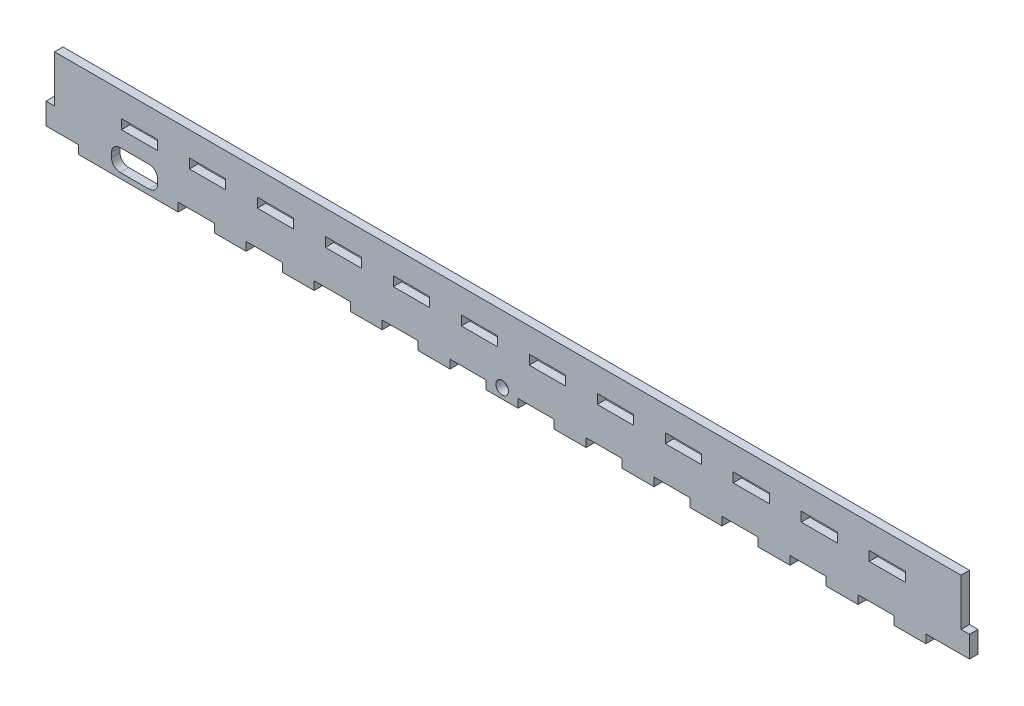
from build123d import *

# Parameters (mm, degrees)
ESQUISSE1_W             = 217.36
ESQUISSE1_H             = 12.11
BOSS_EXTRU_1_DEPTH      = 2
ESQUISSE2_W             = 8.5
ESQUISSE2_H             = 2
ESQUISSE2_W_2           = 10.25
ENL_V_MAT_EXTRU_1_DEPTH = 109.866916118
ENL_V_MAT_EXTRU_2_DEPTH = 109.866916118
ESQUISSE5_W             = 2
ESQUISSE5_H             = 5.055
ENL_V_MAT_EXTRU_3_DEPTH = 109.866916118
ESQUISSE6_W             = 213.36
ESQUISSE6_H             = 6
BOSS_EXTRU_2_DEPTH      = 2
ESQUISSE7_W             = 8.5
ESQUISSE7_H             = 0.25
ENL_V_MAT_EXTRU_4_DEPTH = 110.364827184
SKETCH1_R               = 1.5
CUT_EXTRUDE1_DEPTH      = 110.364827184


with BuildPart() as part:
    # Esquisse1 → Boss.-Extru.1 (new body)
    with BuildSketch(Plane.XY):
        Rectangle(ESQUISSE1_W, ESQUISSE1_H)
    extrude(amount=BOSS_EXTRU_1_DEPTH)

    # Esquisse2 → Enlèv. mat.-Extru.1 (cut, through all)
    with BuildSketch(Plane.XY.offset(2)):
        Polygon((-109.57, -4.055), (-108.68, -4.055), (-101.07, -4.055), (-101.07, -6.055), (-109.57, -6.055), align=None)
        with Locations((-86.68, 5.055)):
            Rectangle(ESQUISSE2_W, ESQUISSE2_H)
        with Locations((-73.32, -5.055)):
            Rectangle(ESQUISSE2_W, ESQUISSE2_H)
        with Locations((-57.32, -5.055)):
            Rectangle(ESQUISSE2_W, ESQUISSE2_H)
        with Locations((-41.32, -5.055)):
            Rectangle(ESQUISSE2_W, ESQUISSE2_H)
        with Locations((-25.32, -5.055)):
            Rectangle(ESQUISSE2_W, ESQUISSE2_H)
        with Locations((-9.32, -5.055)):
            Rectangle(ESQUISSE2_W, ESQUISSE2_H)
        with Locations((6.68, -5.055)):
            Rectangle(ESQUISSE2_W, ESQUISSE2_H)
        with Locations((22.68, -5.055)):
            Rectangle(ESQUISSE2_W, ESQUISSE2_H)
        with Locations((38.68, -5.055)):
            Rectangle(ESQUISSE2_W, ESQUISSE2_H)
        with Locations((54.68, -5.055)):
            Rectangle(ESQUISSE2_W, ESQUISSE2_H)
        with Locations((70.68, -5.055)):
            Rectangle(ESQUISSE2_W, ESQUISSE2_H)
        with Locations((86.68, -5.055)):
            Rectangle(ESQUISSE2_W, ESQUISSE2_H)
        with Locations((-70.68, 5.055)):
            Rectangle(ESQUISSE2_W, ESQUISSE2_H)
        with Locations((-54.68, 5.055)):
            Rectangle(ESQUISSE2_W, ESQUISSE2_H)
        with Locations((-38.68, 5.055)):
            Rectangle(ESQUISSE2_W, ESQUISSE2_H)
        with Locations((-22.68, 5.055)):
            Rectangle(ESQUISSE2_W, ESQUISSE2_H)
        with Locations((-6.68, 5.055)):
            Rectangle(ESQUISSE2_W, ESQUISSE2_H)
        with Locations((9.32, 5.055)):
            Rectangle(ESQUISSE2_W, ESQUISSE2_H)
        with Locations((25.32, 5.055)):
            Rectangle(ESQUISSE2_W, ESQUISSE2_H)
        with Locations((41.32, 5.055)):
            Rectangle(ESQUISSE2_W, ESQUISSE2_H)
        with Locations((57.32, 5.055)):
            Rectangle(ESQUISSE2_W, ESQUISSE2_H)
        with Locations((73.32, 5.055)):
            Rectangle(ESQUISSE2_W, ESQUISSE2_H)
        with Locations((89.32, 5.055)):
            Rectangle(ESQUISSE2_W, ESQUISSE2_H)
        with Locations((103.555, -5.055)):
            Rectangle(ESQUISSE2_W_2, ESQUISSE2_H)
    extrude(amount=-ENL_V_MAT_EXTRU_1_DEPTH, mode=Mode.SUBTRACT)

    # Esquisse3 → Enlèv. mat.-Extru.2 (cut, through all)
    with BuildSketch(Plane.XY.offset(2)):
        with BuildLine():
            Line((-91.252, 0.255), (-84.412, 0.255))
            ThreePointArc((-84.412, 0.255), (-82.997786438, -0.330786438), (-82.412, -1.745))
            Line((-82.412, -1.745), (-82.412, -2.805))
            ThreePointArc((-82.412, -2.805), (-82.997786438, -4.219213562), (-84.412, -4.805))
            Line((-84.412, -4.805), (-91.252, -4.805))
            ThreePointArc((-91.252, -4.805), (-92.666213562, -4.219213562), (-93.252, -2.805))
            Line((-93.252, -2.805), (-93.252, -1.745))
            ThreePointArc((-93.252, -1.745), (-92.666213562, -0.330786438), (-91.252, 0.255))
        make_face()
    extrude(amount=-ENL_V_MAT_EXTRU_2_DEPTH, mode=Mode.SUBTRACT)

    # Esquisse5 → Enlèv. mat.-Extru.3 (cut, through all)
    with BuildSketch(Plane.XY.offset(2)):
        with Locations((-107.68, 3.5275)):
            Rectangle(ESQUISSE5_W, ESQUISSE5_H)
        with Locations((107.68, 3.5275)):
            Rectangle(ESQUISSE5_W, ESQUISSE5_H)
    extrude(amount=-ENL_V_MAT_EXTRU_3_DEPTH, mode=Mode.SUBTRACT)

    # Esquisse6 → Boss.-Extru.2 (add)
    with BuildSketch(Plane.XY.offset(2)):
        with Locations((0, 9.055)):
            Rectangle(ESQUISSE6_W, ESQUISSE6_H)
    extrude(amount=-BOSS_EXTRU_2_DEPTH)

    # Esquisse7 → Enlèv. mat.-Extru.4 (cut, through all)
    with BuildSketch(Plane.XY.offset(2)):
        with Locations((-70.68, 6.18)):
            Rectangle(ESQUISSE7_W, ESQUISSE7_H)
        with Locations((-86.68, 6.18)):
            Rectangle(ESQUISSE7_W, ESQUISSE7_H)
        with Locations((-54.68, 6.18)):
            Rectangle(ESQUISSE7_W, ESQUISSE7_H)
        with Locations((-38.68, 6.18)):
            Rectangle(ESQUISSE7_W, ESQUISSE7_H)
        with Locations((-22.68, 6.18)):
            Rectangle(ESQUISSE7_W, ESQUISSE7_H)
        with Locations((-6.68, 6.18)):
            Rectangle(ESQUISSE7_W, ESQUISSE7_H)
        with Locations((9.32, 6.18)):
            Rectangle(ESQUISSE7_W, ESQUISSE7_H)
        with Locations((25.32, 6.18)):
            Rectangle(ESQUISSE7_W, ESQUISSE7_H)
        with Locations((41.32, 6.18)):
            Rectangle(ESQUISSE7_W, ESQUISSE7_H)
        with Locations((57.32, 6.18)):
            Rectangle(ESQUISSE7_W, ESQUISSE7_H)
        with Locations((73.32, 6.18)):
            Rectangle(ESQUISSE7_W, ESQUISSE7_H)
        with Locations((89.32, 6.18)):
            Rectangle(ESQUISSE7_W, ESQUISSE7_H)
    extrude(amount=-ENL_V_MAT_EXTRU_4_DEPTH, mode=Mode.SUBTRACT)

    # Sketch1 → Cut-Extrude1 (cut, through all)
    with BuildSketch(Plane.XY.offset(2)):
        with Locations((-1.32, -3.725)):
            Circle(SKETCH1_R)
    extrude(amount=-CUT_EXTRUDE1_DEPTH, mode=Mode.SUBTRACT)


solid = part.part
